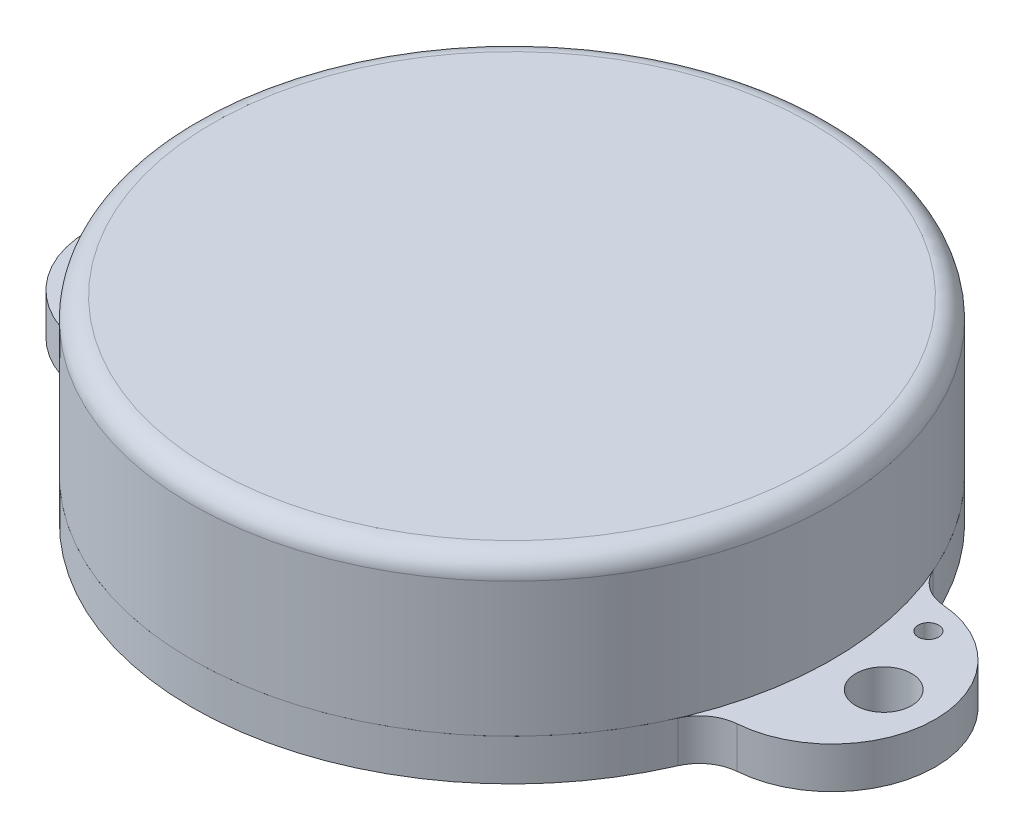
from build123d import *

# Parameters (mm, degrees)
SKETCH1_R           = 1.35
SKETCH1_R_2         = 0.5
BOSS_EXTRUDE1_DEPTH = 2
SKETCH2_R           = 15.5
BOSS_EXTRUDE2_DEPTH = 7.5
FILLET1_R           = 1


with BuildPart() as part:
    # Sketch1 → Boss-Extrude1 (new body)
    with BuildSketch(Plane(origin=(0, 0, 0), x_dir=(1, 0, 0), z_dir=(0, 1, 0))):
        with BuildLine():
            ThreePointArc((-14.214285714, -6.180945044), (0, -15.5), (14.214285714, -6.180945044))
            ThreePointArc((14.214285714, -6.180945044), (14.887096774, -5.35017286), (15.891705069, -4.9846331))
            ThreePointArc((15.891705069, -4.9846331), (20.5, 0), (15.891705069, 4.9846331))
            ThreePointArc((15.891705069, 4.9846331), (14.887096774, 5.35017286), (14.214285714, 6.180945044))
            ThreePointArc((14.214285714, 6.180945044), (0, 15.5), (-14.214285714, 6.180945044))
            ThreePointArc((-14.214285714, 6.180945044), (-14.887096774, 5.35017286), (-15.891705069, 4.9846331))
            ThreePointArc((-15.891705069, 4.9846331), (-20.5, 0), (-15.891705069, -4.9846331))
            ThreePointArc((-15.891705069, -4.9846331), (-14.887096774, -5.35017286), (-14.214285714, -6.180945044))
        make_face()
        with Locations(Location((-18, 0, 0), (0, 0, 270))):
            Circle(SKETCH1_R, mode=Mode.SUBTRACT)
        with Locations(Location((18, 0, 0), (0, 0, 270))):
            Circle(SKETCH1_R, mode=Mode.SUBTRACT)
        with Locations(Location((16.628509212, 3.534498744, 0), (0, 0, 270))):
            Circle(SKETCH1_R_2, mode=Mode.SUBTRACT)
        with Locations(Location((-16.628509212, -3.534498744, 0), (0, 0, 270))):
            Circle(SKETCH1_R_2, mode=Mode.SUBTRACT)
    extrude(amount=BOSS_EXTRUDE1_DEPTH)


with BuildPart() as body_2:
    # Sketch2 → Boss-Extrude2 (new body)
    with BuildSketch(Plane(origin=(0, 2, 0), x_dir=(1, 0, 0), z_dir=(0, 1, 0))):
        with Locations(Location((0, 0, 0), (0, 0, 270))):
            Circle(SKETCH2_R)
    extrude(amount=BOSS_EXTRUDE2_DEPTH)

    # Fillet1
    fillet1_edges = [body_2.edges().sort_by_distance(p)[0] for p in [
        (0, 9.5, -15.5),
    ]]
    fillet(fillet1_edges, radius=FILLET1_R)


solid = Compound([part.part, body_2.part])
